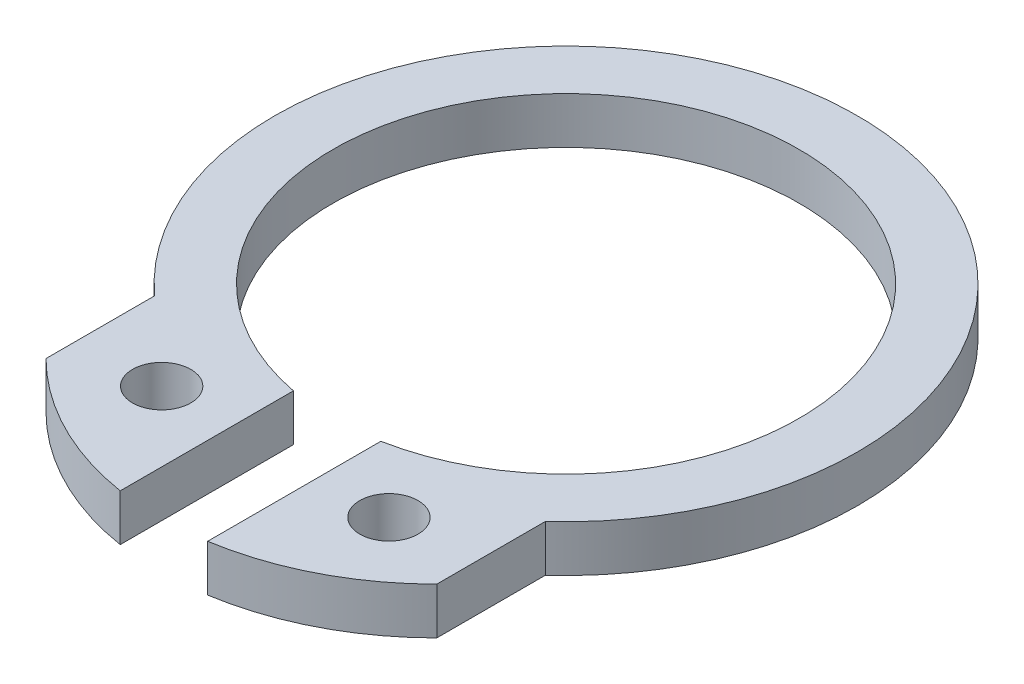
from build123d import *

# Parameters (mm, degrees)
CROQUIS1_R              = 0.5
SALIENTE_EXTRUIR1_DEPTH = 0.8


with BuildPart() as part:
    # Croquis1 → Saliente-Extruir1 (new body)
    with BuildSketch(Plane(origin=(0, 0, 0), x_dir=(1, 0, 0), z_dir=(0, 1, 0))):
        with BuildLine():
            Line((-3.353398235, -3.708735671), (-3.353398235, -5.572470944))
            ThreePointArc((-3.353398235, -5.572470944), (-2.156677316, -6.442732544), (-0.75, -6.9018133))
            Line((-0.75, -6.9018133), (-0.75, -3.929058411))
            ThreePointArc((-0.75, -3.929058411), (0, 4), (0.75, -3.929058411))
            Line((0.75, -3.929058411), (0.75, -6.9018133))
            ThreePointArc((0.75, -6.9018133), (2.156677316, -6.442732544), (3.353398235, -5.572470944))
            Line((3.353398235, -5.572470944), (3.353398235, -3.708735671))
            ThreePointArc((3.353398235, -3.708735671), (0, 5), (-3.353398235, -3.708735671))
        make_face()
        with Locations(Location((-1.95, -4.990609766, 0), (0, 0, 270))):
            Circle(CROQUIS1_R, mode=Mode.SUBTRACT)
        with Locations(Location((1.95, -4.990609766, 0), (0, 0, 270))):
            Circle(CROQUIS1_R, mode=Mode.SUBTRACT)
    extrude(amount=SALIENTE_EXTRUIR1_DEPTH)


solid = part.part
